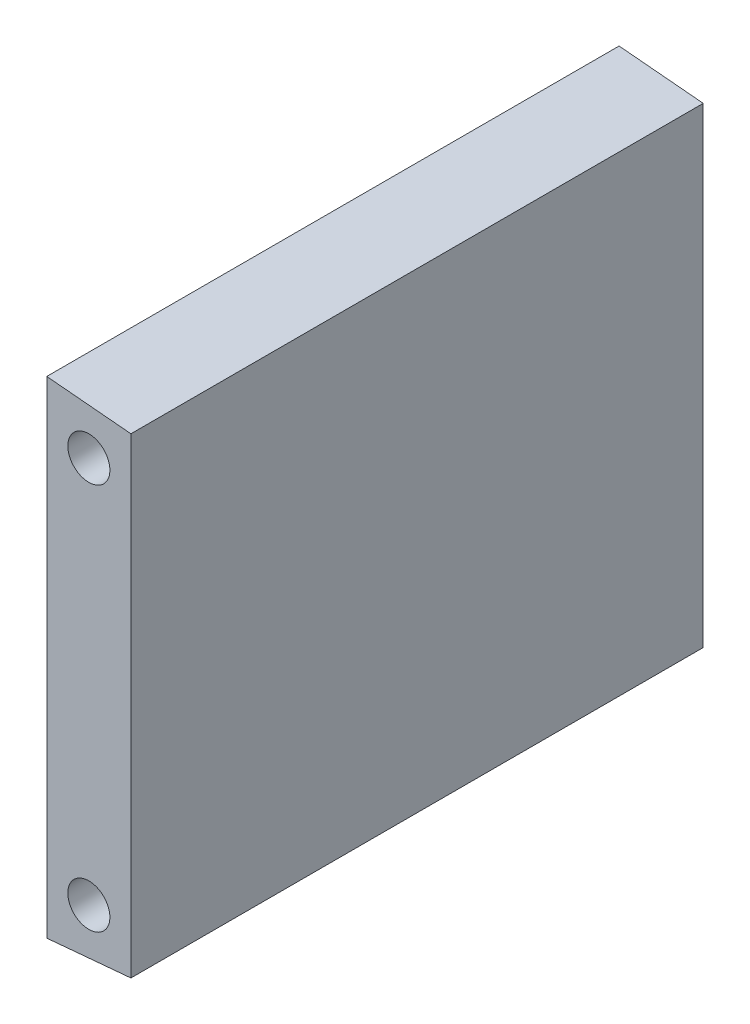
from build123d import *

# Parameters (mm, degrees)
SKETCH1_R           = 2.5
BOSS_EXTRUDE1_DEPTH = 80
BOSS_EXTRUDE2_START = -74
SKETCH2_R           = 2.5
BOSS_EXTRUDE2_DEPTH = 74
SKETCH3_R           = 2.5
CUT_EXTRUDE1_DEPTH  = 6
SKETCH4_R           = 2.5
CUT_EXTRUDE2_DEPTH  = 6
CUT_EXTRUDE3_DEPTH  = 12
CUT_EXTRUDE4_START  = -6
SKETCH6_R           = 2.5
CUT_EXTRUDE4_DEPTH  = 6


with BuildPart() as part:
    # Sketch1 → Boss-Extrude1 (new body)
    with BuildSketch(Plane.XY):
        Polygon((5, 28), (-5, 28.9), (-5, -28.9), (5, -28), align=None)
        with Locations((0, -23)):
            Circle(SKETCH1_R, mode=Mode.SUBTRACT)
        with Locations((0, 23)):
            Circle(SKETCH1_R, mode=Mode.SUBTRACT)
    extrude(amount=BOSS_EXTRUDE1_DEPTH)

    # Sketch2 → Boss-Extrude2 (add)
    with BuildSketch(Plane.XY.offset(80).offset(BOSS_EXTRUDE2_START)):
        with Locations((0, 23)):
            Circle(SKETCH2_R)
        with Locations((0, -23)):
            Circle(SKETCH2_R)
    extrude(amount=BOSS_EXTRUDE2_DEPTH)

    # Sketch3 → Cut-Extrude1 (cut)
    with BuildSketch(Plane.XY.offset(80)):
        with Locations((0, 23.038742356)):
            Circle(SKETCH3_R)
    extrude(amount=-CUT_EXTRUDE1_DEPTH, mode=Mode.SUBTRACT)

    # Sketch4 → Cut-Extrude2 (cut)
    with BuildSketch(Plane.XY.offset(80)):
        with Locations((0, -23.038742356)):
            Circle(SKETCH4_R)
    extrude(amount=-CUT_EXTRUDE2_DEPTH, mode=Mode.SUBTRACT)

    # Sketch5 → Cut-Extrude3 (cut)
    with BuildSketch(Plane.XY.offset(80)):
        Polygon((-5, 28.9), (5, 28), (5, -28), (-5, -28.9), align=None)
    extrude(amount=-CUT_EXTRUDE3_DEPTH, mode=Mode.SUBTRACT)

    # Sketch6 → Cut-Extrude4 (cut)
    with BuildSketch(Plane.XY.offset(68).offset(CUT_EXTRUDE4_START)):
        with Locations((0, 23)):
            Circle(SKETCH6_R)
        with Locations((0, -23)):
            Circle(SKETCH6_R)
    extrude(amount=CUT_EXTRUDE4_DEPTH, mode=Mode.SUBTRACT)


solid = part.part
